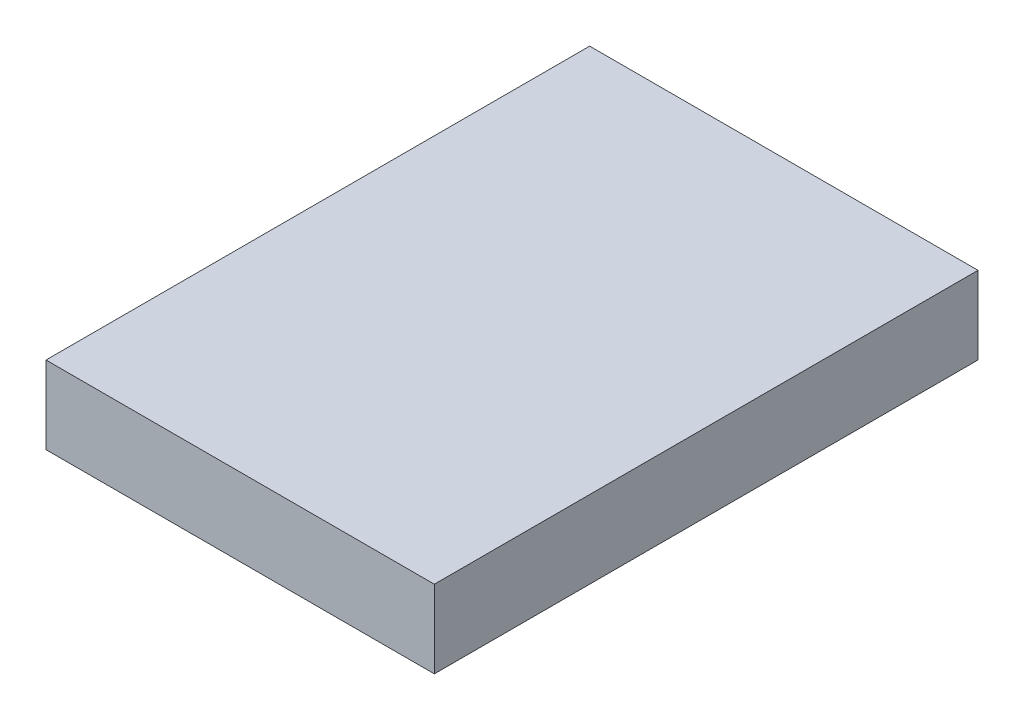
from build123d import *

# Parameters (mm, degrees)
SKETCH_1_W      = 50
SKETCH_1_H      = 70
EXTRUDE_1_DEPTH = 10


with BuildPart() as part:
    # 草图1 → 凸台-拉伸1 (new body)
    with BuildSketch(Plane(origin=(0, 0, 0), x_dir=(1, 0, 0), z_dir=(0, 1, 0))):
        Rectangle(SKETCH_1_W, SKETCH_1_H)
    extrude(amount=EXTRUDE_1_DEPTH)


solid = part.part
